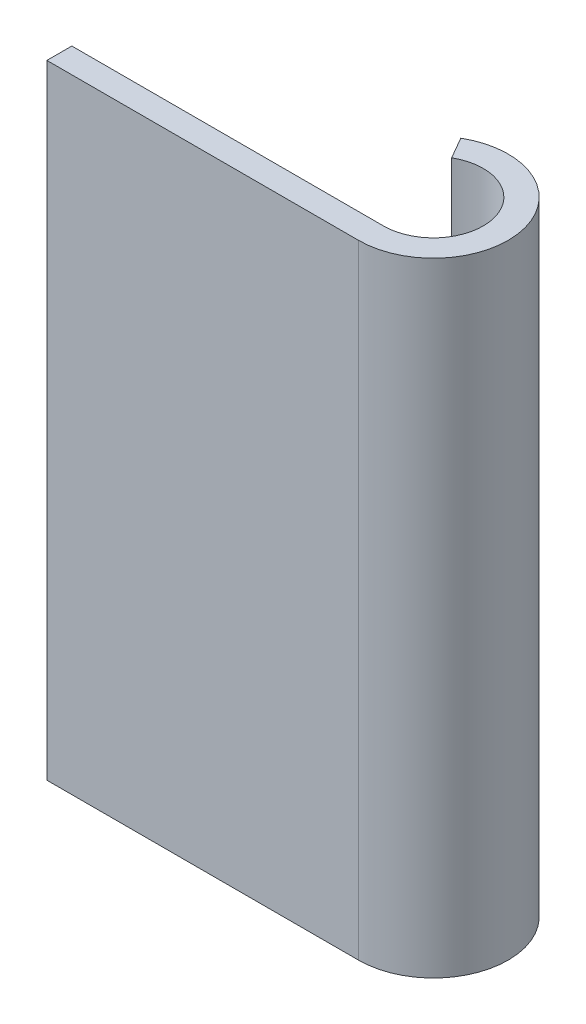
from build123d import *

# Parameters (mm, degrees)
BOSS_EXTRUDE1_DEPTH = 40


with BuildPart() as part:
    # Sketch1 → Boss-Extrude1 (new body)
    with BuildSketch(Plane(origin=(0, 0, 0), x_dir=(1, 0, 0), z_dir=(0, 1, 0))):
        with BuildLine():
            Line((0, -3.2), (-20, -3.2))
            Line((-20, -3.2), (-20, -4.8))
            Line((-20, -4.8), (0, -4.8))
            ThreePointArc((0, -4.8), (4.636443966, 1.242331416), (-2.4, 4.156921938))
            Line((-2.4, 4.156921938), (-1.6, 2.771281292))
            ThreePointArc((-1.6, 2.771281292), (3.090962644, 0.828220944), (0, -3.2))
        make_face()
    extrude(amount=BOSS_EXTRUDE1_DEPTH)


solid = part.part
